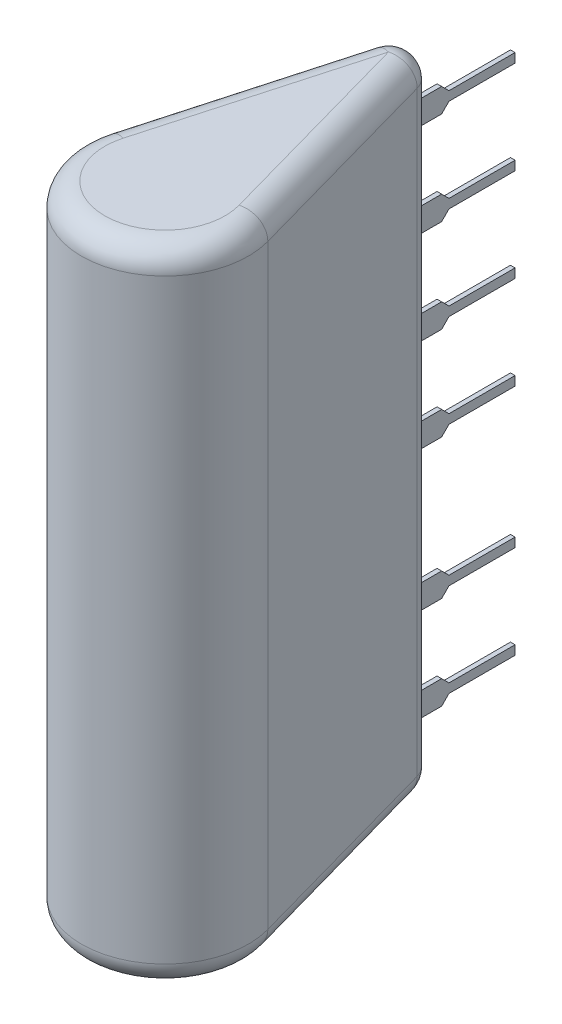
from build123d import *

# Parameters (mm, degrees)
BOSS_EXTRUDE1_DEPTH = 17.5
FILLET1_R           = 1.27
SKETCH2_W           = 0.25
SKETCH2_H           = 1.3
BOSS_EXTRUDE2_DEPTH = 6
CUT_EXTRUDE1_REACH  = 28.615
LPATTERN1_COUNT     = 4
LPATTERN1_PITCH     = 5.08
SKETCH4_W           = 0.25
SKETCH4_H           = 1.3
BOSS_EXTRUDE3_DEPTH = 6
CUT_EXTRUDE2_REACH  = 28.615
LPATTERN3_COUNT     = 2
LPATTERN3_PITCH     = 5.08


with BuildPart() as part:
    # Sketch1 → Boss-Extrude1 (new, symmetric)
    with BuildSketch(Plane(origin=(0, 0, 0), x_dir=(1, 0, 0), z_dir=(0, 1, 0))):
        with BuildLine():
            Line((-1.223083707, -2.427996716), (-4.381914067, -13.724712644))
            ThreePointArc((-4.381914067, -13.724712644), (0, -19.5), (4.381914067, -13.724712644))
            Line((4.381914067, -13.724712644), (1.223083707, -2.427996716))
            ThreePointArc((1.223083707, -2.427996716), (0, -1.5), (-1.223083707, -2.427996716))
        make_face()
    extrude(amount=BOSS_EXTRUDE1_DEPTH, both=True)

    # Fillet1
    fillet1_edges = [part.edges().sort_by_distance(p)[0] for p in [
        (0, 17.5, 19.5),
        (2.802498887, 17.5, 8.07635468),
        (0, 17.5, 1.5),
        (2.802498887, -17.5, 8.07635468),
        (0, -17.5, 19.5),
        (-2.802498887, -17.5, 8.07635468),
        (0, -17.5, 1.5),
        (-2.802498887, 17.5, 8.07635468),
    ]]
    fillet(fillet1_edges, radius=FILLET1_R)

    # Sketch2 → Boss-Extrude2 (add)
    with BuildSketch(Plane.XY.offset(2)):
        with Locations((0, 13.9)):
            Rectangle(SKETCH2_W, SKETCH2_H)
    boss_extrude2 = extrude(amount=-BOSS_EXTRUDE2_DEPTH)

    # Sketch3 → Cut-Extrude1 (cut, up to next)
    with BuildSketch(Plane(origin=(0.125, 0, 0), x_dir=(0, 0, -1), z_dir=(1, 0, 0)), mode=Mode.PRIVATE) as cut_extrude1_sk1:
        Polygon((4, 14.150000008), (0.399999992, 14.150000008), (0, 14.55), (4, 14.55), align=None)
    cut_extrude1_tool1 = extrude(cut_extrude1_sk1.sketch, amount=-CUT_EXTRUDE1_REACH, mode=Mode.PRIVATE) & part.part
    # Sketch3 → Cut-Extrude1 (cut, up to next)
    with BuildSketch(Plane(origin=(0.125, 0, 0), x_dir=(0, 0, -1), z_dir=(1, 0, 0)), mode=Mode.PRIVATE) as cut_extrude1_sk2:
        Polygon((4, 13.25), (4, 13.649999992), (0.399999992, 13.649999992), (0, 13.25), align=None)
    cut_extrude1_tool2 = extrude(cut_extrude1_sk2.sketch, amount=-CUT_EXTRUDE1_REACH, mode=Mode.PRIVATE) & part.part
    cut_extrude1_1 = cut_extrude1_tool1.solids().sort_by_distance((0.125, 14.353509, -2.098246))[0]
    add(cut_extrude1_1, mode=Mode.SUBTRACT)
    cut_extrude1_2 = cut_extrude1_tool2.solids().sort_by_distance((0.125, 13.446491, -2.098246))[0]
    add(cut_extrude1_2, mode=Mode.SUBTRACT)
    cut_extrude1 = cut_extrude1_1 + cut_extrude1_2  # Cut-Extrude1 as one shape, for the pattern or mirror that repeats it

    # LPattern1: Boss-Extrude2, Cut-Extrude1 ×4
    with Locations(*[(0, -i * LPATTERN1_PITCH, 0) for i in range(1, LPATTERN1_COUNT)]):
        add(boss_extrude2)
        add(cut_extrude1, mode=Mode.SUBTRACT)

    # Sketch4 → Boss-Extrude3 (add)
    with BuildSketch(Plane.XY.offset(2)):
        with Locations((0, -8.96)):
            Rectangle(SKETCH4_W, SKETCH4_H)
    boss_extrude3 = extrude(amount=-BOSS_EXTRUDE3_DEPTH)

    # Sketch5 → Cut-Extrude2 (cut, up to next)
    with BuildSketch(Plane(origin=(0.125, 0, 0), x_dir=(0, 0, -1), z_dir=(1, 0, 0)), mode=Mode.PRIVATE) as cut_extrude2_sk1:
        Polygon((4, -8.709999992), (0.399999992, -8.709999992), (0, -8.31), (4, -8.31), align=None)
    cut_extrude2_tool1 = extrude(cut_extrude2_sk1.sketch, amount=-CUT_EXTRUDE2_REACH, mode=Mode.PRIVATE) & part.part
    # Sketch5 → Cut-Extrude2 (cut, up to next)
    with BuildSketch(Plane(origin=(0.125, 0, 0), x_dir=(0, 0, -1), z_dir=(1, 0, 0)), mode=Mode.PRIVATE) as cut_extrude2_sk2:
        Polygon((4, -9.61), (4, -9.210000008), (0.399999992, -9.210000008), (0, -9.61), align=None)
    cut_extrude2_tool2 = extrude(cut_extrude2_sk2.sketch, amount=-CUT_EXTRUDE2_REACH, mode=Mode.PRIVATE) & part.part
    cut_extrude2_1 = cut_extrude2_tool1.solids().sort_by_distance((0.125, -8.506491, -2.098246))[0]
    add(cut_extrude2_1, mode=Mode.SUBTRACT)
    cut_extrude2_2 = cut_extrude2_tool2.solids().sort_by_distance((0.125, -9.413509, -2.098246))[0]
    add(cut_extrude2_2, mode=Mode.SUBTRACT)
    cut_extrude2 = cut_extrude2_1 + cut_extrude2_2  # Cut-Extrude2 as one shape, for the pattern or mirror that repeats it

    # LPattern3: Boss-Extrude3, Cut-Extrude2 ×2
    with Locations(*[(0, -i * LPATTERN3_PITCH, 0) for i in range(1, LPATTERN3_COUNT)]):
        add(boss_extrude3)
        add(cut_extrude2, mode=Mode.SUBTRACT)


solid = part.part
